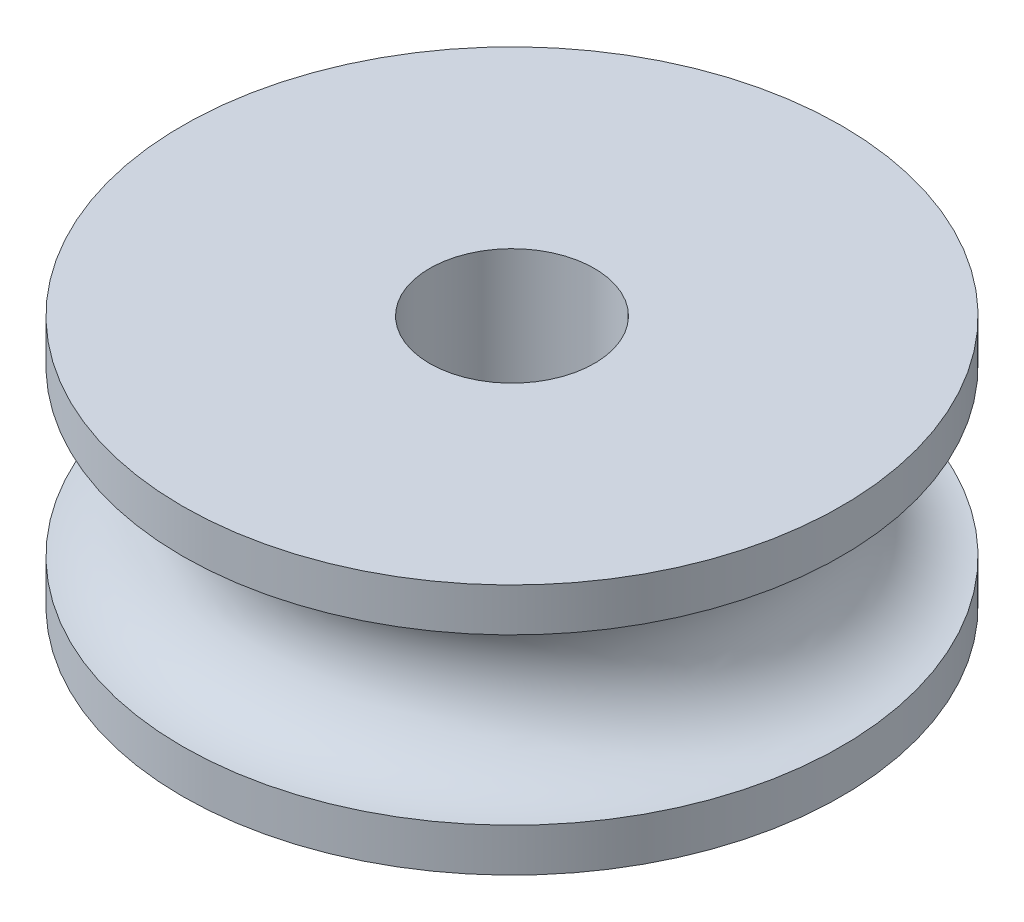
from build123d import *

# Parameters (mm, degrees)
CROQUIS2_R            = 9.525
CORTAR_EXTRUIR1_DEPTH = 40


with BuildPart() as part:
    # Croquis1 → Revolución1 (revolve)
    with BuildSketch(Plane.XY, mode=Mode.PRIVATE) as revoluci_n1_sk:
        with BuildLine():
            Line((0, 0), (0, 14.525))
            Line((0, 14.525), (-38.1, 14.525))
            Line((-38.1, 14.525), (-38.1, 9.525))
            ThreePointArc((-38.1, 9.525), (-31.364807909, 6.735192091), (-28.575, 0))
            Line((-28.575, 0), (0, 0))
        make_face()
        with BuildLine():
            Line((0, -14.525), (0, 0))
            Line((0, 0), (-28.575, 0))
            ThreePointArc((-28.575, 0), (-31.364807909, -6.735192091), (-38.1, -9.525))
            Line((-38.1, -9.525), (-38.1, -14.525))
            Line((-38.1, -14.525), (0, -14.525))
        make_face()
    revolve(revoluci_n1_sk.sketch.rotate(Axis((0, 62.433588071, 0), (0, -1, 0)), 270), axis=Axis((0, 62.433588071, 0), (0, -1, 0)))

    # Croquis2 → Cortar-Extruir1 (cut)
    with BuildSketch(Plane(origin=(0, 14.525, 0), x_dir=(1, 0, 0), z_dir=(0, 1, 0))):
        with Locations(Location((0, 0, 0), (0, 0, 270))):
            Circle(CROQUIS2_R)
    extrude(amount=-CORTAR_EXTRUIR1_DEPTH, mode=Mode.SUBTRACT)


solid = part.part
